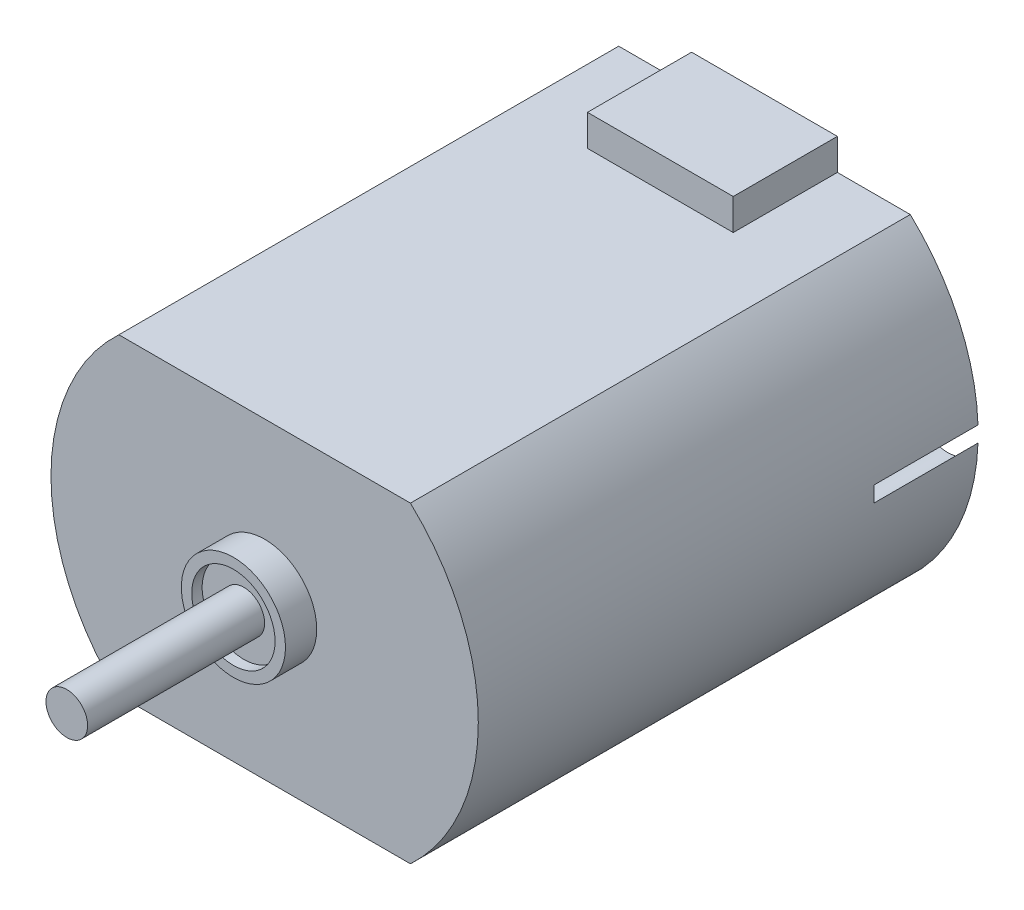
from build123d import *

# Parameters (mm, degrees)
SALIENTE_EXTRUIR2_DEPTH = 19
CROQUIS3_R              = 2.5
SALIENTE_EXTRUIR3_DEPTH = 1.5
CROQUIS4_R              = 2
CORTAR_EXTRUIR1_DEPTH   = 0.5
CROQUIS5_R              = 1
SALIENTE_EXTRUIR4_DEPTH = 8.5
SALIENTE_EXTRUIR5_START = 5
SALIENTE_EXTRUIR5_DEPTH = 5
SALIENTE_EXTRUIR6_DEPTH = 2
CORTAR_EXTRUIR2_START   = -0.01
CROQUIS8_R              = 2
CORTAR_EXTRUIR2_DEPTH   = 0.01
SALIENTE_EXTRUIR7_START = 0.9
CROQUIS9_R              = 1
SALIENTE_EXTRUIR7_DEPTH = 0.9
CROQUIS10_W             = 7
CROQUIS10_H             = 1.5
SALIENTE_EXTRUIR8_DEPTH = 5


with BuildPart() as part:
    # Croquis2 → Saliente-Extruir2 (new body)
    with BuildSketch(Plane.XY):
        with BuildLine():
            Line((-7, 7.5), (7, 7.5))
            ThreePointArc((7, 7.5), (10.259142264, 0), (7, -7.5))
            Line((7, -7.5), (-7, -7.5))
            ThreePointArc((-7, -7.5), (-10.259142264, 0), (-7, 7.5))
        make_face()
    extrude(amount=SALIENTE_EXTRUIR2_DEPTH)

    # Croquis3 → Saliente-Extruir3 (add)
    with BuildSketch(Plane.XY.offset(19)):
        Circle(CROQUIS3_R)
    extrude(amount=SALIENTE_EXTRUIR3_DEPTH)

    # Croquis4 → Cortar-Extruir1 (cut)
    with BuildSketch(Plane.XY.offset(20.5)):
        Circle(CROQUIS4_R)
    extrude(amount=-CORTAR_EXTRUIR1_DEPTH, mode=Mode.SUBTRACT)

    # Croquis5 → Saliente-Extruir4 (add)
    with BuildSketch(Plane.XY.offset(20)):
        Circle(CROQUIS5_R)
    extrude(amount=SALIENTE_EXTRUIR4_DEPTH)

    # Croquis6 → Saliente-Extruir5 (add)
    with BuildSketch(Plane(origin=(0, 0, 0), x_dir=(-1, 0, 0), z_dir=(0, 0, -1)).offset(SALIENTE_EXTRUIR5_START)):
        with BuildLine():
            Line((-7, 7.5), (7, 7.5))
            ThreePointArc((7, 7.5), (9.332754717, 4.260245227), (10.252272727, 0.375371717))
            ThreePointArc((10.252272727, 0.375371717), (7.3, 0), (10.252272727, -0.375371717))
            ThreePointArc((10.252272727, -0.375371717), (9.332754717, -4.260245227), (7, -7.5))
            Line((7, -7.5), (-7, -7.5))
            ThreePointArc((-7, -7.5), (-9.332754717, -4.260245227), (-10.252272727, -0.375371717))
            ThreePointArc((-10.252272727, -0.375371717), (-7.3, 0), (-10.252272727, 0.375371717))
            ThreePointArc((-10.252272727, 0.375371717), (-9.332754717, 4.260245227), (-7, 7.5))
        make_face()
    extrude(amount=-SALIENTE_EXTRUIR5_DEPTH)

    # Croquis7 → Saliente-Extruir6 (add)
    with BuildSketch(Plane(origin=(0, 0, -5), x_dir=(-1, 0, 0), z_dir=(0, 0, -1))):
        with BuildLine():
            Line((-3, -3.354101966), (3, -3.354101966))
            ThreePointArc((3, -3.354101966), (0, 4.5), (-3, -3.354101966))
        make_face()
    extrude(amount=SALIENTE_EXTRUIR6_DEPTH)

    # Croquis8 → Cortar-Extruir2 (cut)
    with BuildSketch(Plane(origin=(0, 0, -7), x_dir=(-1, 0, 0), z_dir=(0, 0, -1)).offset(CORTAR_EXTRUIR2_START)):
        with Locations(Location((0, 0, 0), (0, 0, 180))):
            Circle(CROQUIS8_R)
    extrude(amount=CORTAR_EXTRUIR2_DEPTH, mode=Mode.SUBTRACT)

    # Croquis9 → Saliente-Extruir7 (add)
    with BuildSketch(Plane(origin=(0, 0, -6.99), x_dir=(-1, 0, 0), z_dir=(0, 0, -1)).offset(SALIENTE_EXTRUIR7_START)):
        with Locations(Location((0, 0, 0), (0, 0, 180))):
            Circle(CROQUIS9_R)
    extrude(amount=-SALIENTE_EXTRUIR7_DEPTH)

    # Croquis10 → Saliente-Extruir8 (add)
    with BuildSketch(Plane(origin=(0, 0, -5), x_dir=(-1, 0, 0), z_dir=(0, 0, -1))):
        with Locations((0, 8.25)):
            Rectangle(CROQUIS10_W, CROQUIS10_H)
    extrude(amount=-SALIENTE_EXTRUIR8_DEPTH)


solid = part.part
